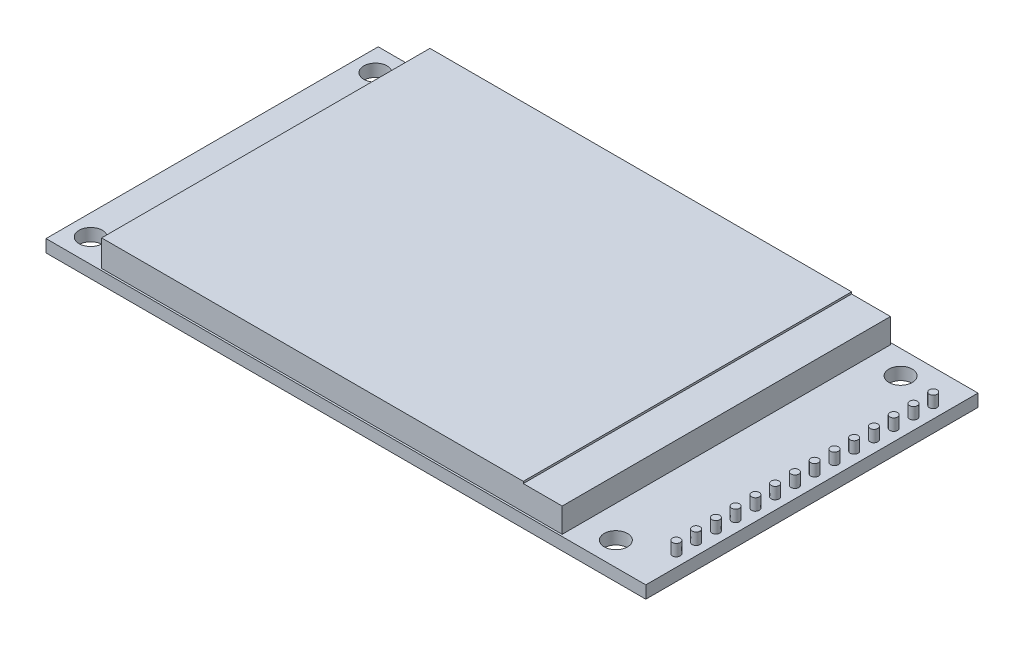
from build123d import *

# Parameters (mm, degrees)
CROQUIS1_W              = 77.1
CROQUIS1_H              = 42.7
SALIENTE_EXTRUIR1_DEPTH = 1.6
CROQUIS2_W              = 59.2
CROQUIS2_H              = 42.2
SALIENTE_EXTRUIR2_DEPTH = 3.4
CORTAR_EXTRUIR2_REACH   = 46.35
CROQUIS4_R              = 1.5
CUT_EXTRUDE1_DEPTH      = 45.350028185
CUT_EXTRUDE1_DEPTH_BACK = 0.25
CROQUIS3_R              = 0.5
BOSS_EXTRUDE1_DEPTH     = 1.5


with BuildPart() as part:
    # Croquis1 → Saliente-Extruir1 (new body)
    with BuildSketch(Plane(origin=(0, 0, 0), x_dir=(1, 0, 0), z_dir=(0, 1, 0))):
        Rectangle(CROQUIS1_W, CROQUIS1_H)
    extrude(amount=SALIENTE_EXTRUIR1_DEPTH)

    # Croquis2 → Saliente-Extruir2 (add)
    with BuildSketch(Plane(origin=(0, 1.6, 0), x_dir=(1, 0, 0), z_dir=(0, 1, 0))):
        with Locations((-2.05, 0)):
            Rectangle(CROQUIS2_W, CROQUIS2_H)
    extrude(amount=SALIENTE_EXTRUIR2_DEPTH)

    # Croquis4 → Cortar-Extruir2 (cut, up to next)
    with BuildSketch(Plane.XZ, mode=Mode.PRIVATE) as cortar_extruir2_sk1:
        with Locations(Location((-35.85, 18.3, 0), (0, 0, 270))):
            Circle(CROQUIS4_R)
    cortar_extruir2_tool1 = extrude(cortar_extruir2_sk1.sketch, amount=-CORTAR_EXTRUIR2_REACH, mode=Mode.PRIVATE) & part.part
    # Croquis4 → Cortar-Extruir2 (cut, up to next)
    with BuildSketch(Plane.XZ, mode=Mode.PRIVATE) as cortar_extruir2_sk2:
        with Locations(Location((31.65, 18.3, 0), (0, 0, 270))):
            Circle(CROQUIS4_R)
    cortar_extruir2_tool2 = extrude(cortar_extruir2_sk2.sketch, amount=-CORTAR_EXTRUIR2_REACH, mode=Mode.PRIVATE) & part.part
    # Croquis4 → Cortar-Extruir2 (cut, up to next)
    with BuildSketch(Plane.XZ, mode=Mode.PRIVATE) as cortar_extruir2_sk3:
        with Locations(Location((31.65, -18.3, 0), (0, 0, 270))):
            Circle(CROQUIS4_R)
    cortar_extruir2_tool3 = extrude(cortar_extruir2_sk3.sketch, amount=-CORTAR_EXTRUIR2_REACH, mode=Mode.PRIVATE) & part.part
    # Croquis4 → Cortar-Extruir2 (cut, up to next)
    with BuildSketch(Plane.XZ, mode=Mode.PRIVATE) as cortar_extruir2_sk4:
        with Locations(Location((-35.85, -18.3, 0), (0, 0, 270))):
            Circle(CROQUIS4_R)
    cortar_extruir2_tool4 = extrude(cortar_extruir2_sk4.sketch, amount=-CORTAR_EXTRUIR2_REACH, mode=Mode.PRIVATE) & part.part
    add(cortar_extruir2_tool1.solids().sort_by_distance((-35.85, 0, 18.3))[0], mode=Mode.SUBTRACT)
    add(cortar_extruir2_tool2.solids().sort_by_distance((31.65, 0, 18.3))[0], mode=Mode.SUBTRACT)
    add(cortar_extruir2_tool3.solids().sort_by_distance((31.65, 0, -18.3))[0], mode=Mode.SUBTRACT)
    add(cortar_extruir2_tool4.solids().sort_by_distance((-35.85, 0, -18.3))[0], mode=Mode.SUBTRACT)

    # Sketch3 → Cut-Extrude1 (cut, two sides: drawn at the far end of the back side and taken through both)
    with BuildSketch(Plane(origin=(0, 5, 0), x_dir=(1, 0, 0), z_dir=(0, 1, 0)).offset(-CUT_EXTRUDE1_DEPTH_BACK)):
        Polygon((22.55, 179.899832697), (22.55, 21.10051324), (22.55, -21.101140947), (22.55, -179.900460404), (340.148638914, -179.900460404), (340.148638914, 179.899832697), align=None)
    extrude(amount=CUT_EXTRUDE1_DEPTH + CUT_EXTRUDE1_DEPTH_BACK, mode=Mode.SUBTRACT)

    # Croquis3 → Boss-Extrude1 (add)
    with BuildSketch(Plane(origin=(0, 1.6, 0), x_dir=(1, 0, 0), z_dir=(0, 1, 0))):
        with Locations(Location((37.05, -15.923235508, 0), (0, 0, 270))):
            Circle(CROQUIS3_R)
        with Locations(Location((37.05, -13.383235508, 0), (0, 0, 270))):
            Circle(CROQUIS3_R)
        with Locations(Location((37.05, -10.843235508, 0), (0, 0, 270))):
            Circle(CROQUIS3_R)
        with Locations(Location((37.05, -8.303235508, 0), (0, 0, 270))):
            Circle(CROQUIS3_R)
        with Locations(Location((37.05, -5.763235508, 0), (0, 0, 270))):
            Circle(CROQUIS3_R)
        with Locations(Location((37.05, -3.223235508, 0), (0, 0, 270))):
            Circle(CROQUIS3_R)
        with Locations(Location((37.05, -0.683235508, 0), (0, 0, 270))):
            Circle(CROQUIS3_R)
        with Locations(Location((37.05, 1.856764492, 0), (0, 0, 270))):
            Circle(CROQUIS3_R)
        with Locations(Location((37.05, 4.396764492, 0), (0, 0, 270))):
            Circle(CROQUIS3_R)
        with Locations(Location((37.05, 6.936764492, 0), (0, 0, 270))):
            Circle(CROQUIS3_R)
        with Locations(Location((37.05, 9.476764492, 0), (0, 0, 270))):
            Circle(CROQUIS3_R)
        with Locations(Location((37.05, 12.016764492, 0), (0, 0, 270))):
            Circle(CROQUIS3_R)
        with Locations(Location((37.05, 14.556764492, 0), (0, 0, 270))):
            Circle(CROQUIS3_R)
        with Locations(Location((37.05, 17.096764492, 0), (0, 0, 270))):
            Circle(CROQUIS3_R)
    extrude(amount=BOSS_EXTRUDE1_DEPTH)


solid = part.part
